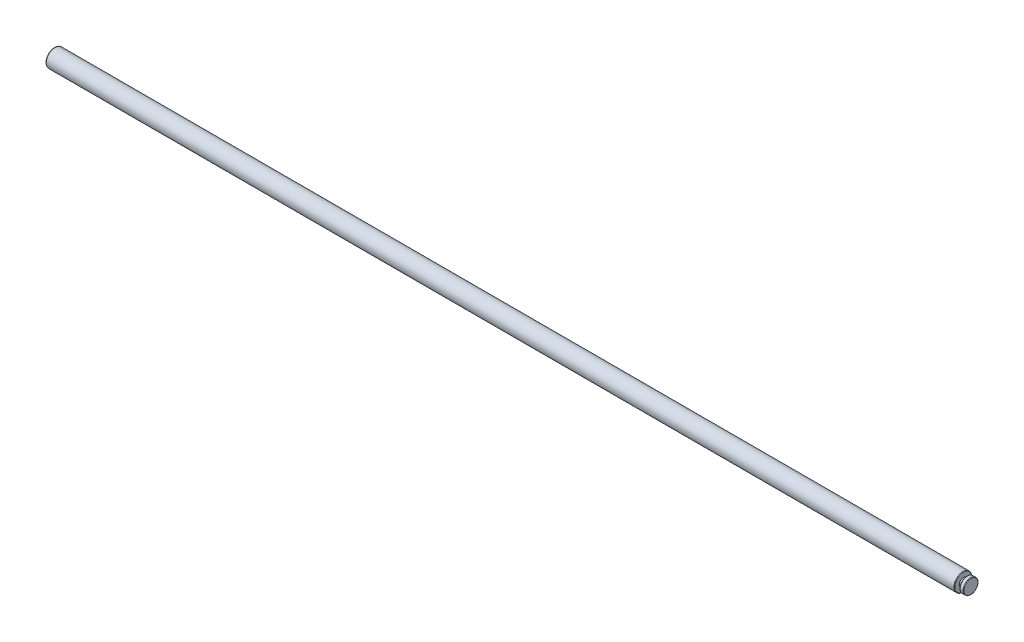
from build123d import *

# Parameters (mm, degrees)
FILLET1_R = 0.2
FILLET2_R = 0.2
FILLET3_R = 0.4


with BuildPart() as part:
    # Sketch1 → Revolve1 (revolve)
    with BuildSketch(Plane.XY, mode=Mode.PRIVATE) as revolve1_sk:
        Polygon((-180, 0), (180, 0), (180, 2.9), (178.5, 2.9), (178.5, 1.5), (177, 1.5), (177, 3.5), (-180, 3.5), align=None)
    revolve(revolve1_sk.sketch.rotate(Axis((-180, 0, 0), (1, 0, 0)), 90), axis=Axis((-180, 0, 0), (1, 0, 0)))

    # Fillet1
    fillet1_edges = [part.edges().sort_by_distance(p)[0] for p in [
        (177, 0, -3.5),
    ]]
    fillet(fillet1_edges, radius=FILLET1_R)

    # Fillet2
    fillet2_edges = [part.edges().sort_by_distance(p)[0] for p in [
        (180, 0, -2.9),
        (178.5, 0, -2.9),
    ]]
    fillet(fillet2_edges, radius=FILLET2_R)

    # Fillet3
    fillet3_edges = [part.edges().sort_by_distance(p)[0] for p in [
        (-180, 0, -3.5),
    ]]
    fillet(fillet3_edges, radius=FILLET3_R)


solid = part.part
